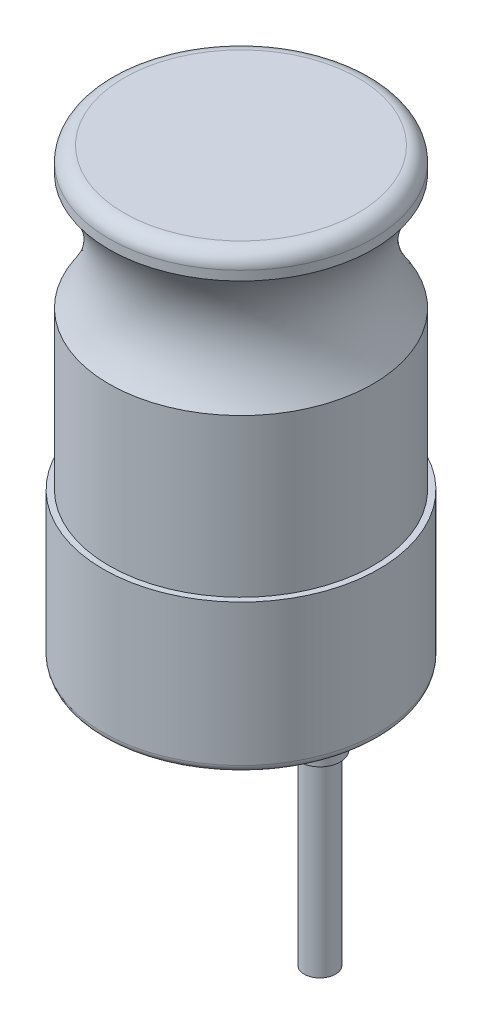
from build123d import *

# Parameters (mm, degrees)
SKETCH1_R           = 18.5
BOSS_EXTRUDE1_DEPTH = 20
SKETCH2_R           = 17.708290072
BOSS_EXTRUDE2_DEPTH = 40
SKETCH3_R           = 2.093314986
BOSS_EXTRUDE3_DEPTH = 30
FILLET1_R           = 2
FILLET2_R           = 1
SKETCH5_R           = 2.748707601
BOSS_EXTRUDE4_DEPTH = 5


with BuildPart() as part:
    # Sketch1 → Boss-Extrude1 (new body)
    with BuildSketch(Plane(origin=(0, 0, 0), x_dir=(1, 0, 0), z_dir=(0, 1, 0))):
        with Locations(Location((0, 0, 0), (0, 0, 270))):
            Circle(SKETCH1_R)
    extrude(amount=BOSS_EXTRUDE1_DEPTH)

    # Sketch2 → Boss-Extrude2 (add)
    with BuildSketch(Plane(origin=(0, 20, 0), x_dir=(1, 0, 0), z_dir=(0, 1, 0))):
        with Locations(Location((0, 0, 0), (0, 0, 270))):
            Circle(SKETCH2_R)
    extrude(amount=BOSS_EXTRUDE2_DEPTH)

    # Sketch3 → Boss-Extrude3 (add)
    with BuildSketch(Plane.XZ):
        with Locations(Location((10.583651539, 0, 0), (0, 0, 90))):
            Circle(SKETCH3_R)
    extrude(amount=BOSS_EXTRUDE3_DEPTH)

    # Sketch4 → Cut-Revolve1 (revolve, cut)
    with BuildSketch(Plane(origin=(0, 0, 0), x_dir=(0, 0, -1), z_dir=(1, 0, 0))):
        with BuildLine():
            add(Edge.make_bspline(
                [(-17.708290072, 56.753435872), (-12.088729605, 49.239761399), (-17.708290072, 41.11831897)],
                knots=[0, 0, 0, 1, 1, 1], degree=2))
            Line((-17.708290072, 41.11831897), (-17.708290072, 56.753435872))
        make_face()
    revolve(axis=Axis((0, 60, 0), (0, -1, 0)), mode=Mode.SUBTRACT)

    # Fillet1
    fillet1_edges = [part.edges().sort_by_distance(p)[0] for p in [
        (0, 60, -17.708290072),
    ]]
    fillet(fillet1_edges, radius=FILLET1_R)

    # Fillet2
    fillet2_edges = [part.edges().sort_by_distance(p)[0] for p in [
        (0, 0, -18.5),
    ]]
    fillet(fillet2_edges, radius=FILLET2_R)

    # Sketch5 → Boss-Extrude4 (add)
    with BuildSketch(Plane.XZ):
        with Locations(Location((10.583651539, 0, 0), (0, 0, 90))):
            Circle(SKETCH5_R)
    extrude(amount=BOSS_EXTRUDE4_DEPTH)


solid = part.part
